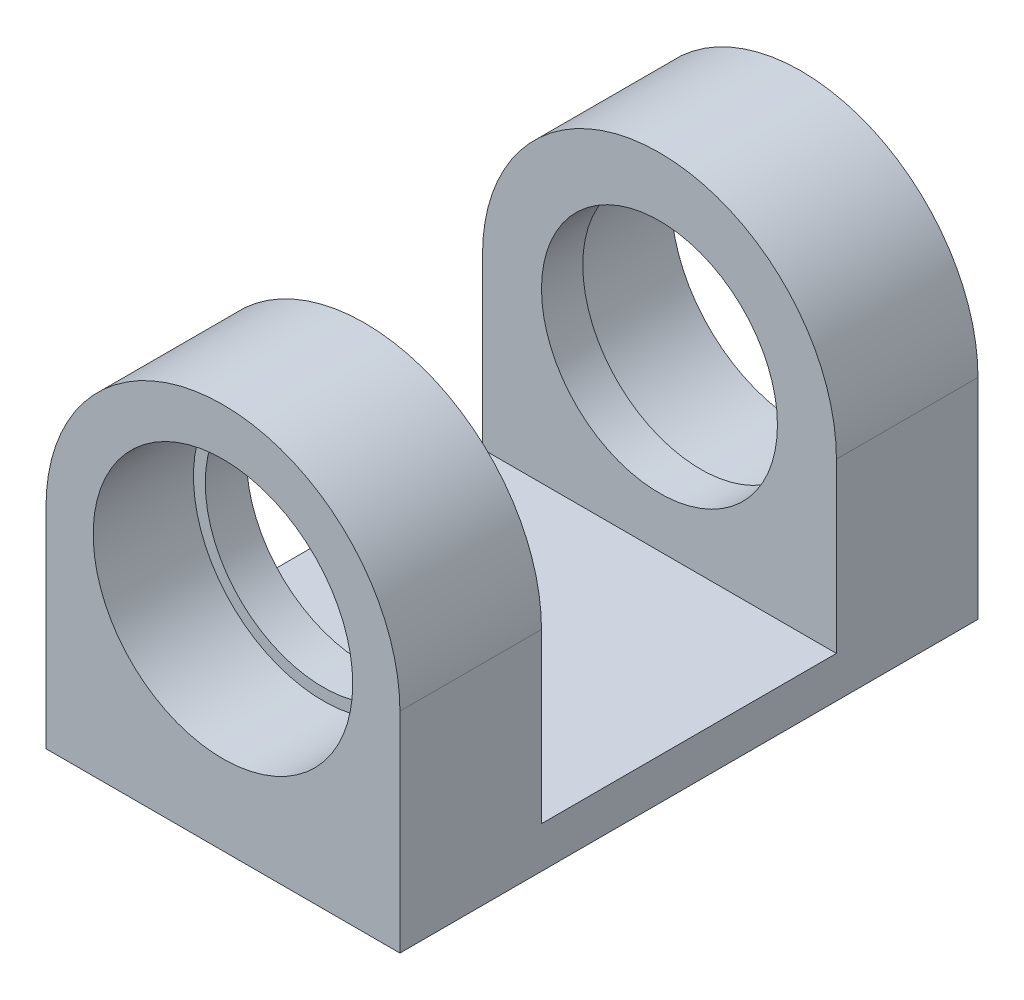
from build123d import *

# Parameters (mm, degrees)
SALIENTE_EXTRUIR1_DEPTH = 6
CROQUIS3_R              = 4
CORTAR_EXTRUIR1_DEPTH   = 47.013232879
CROQUIS4_R              = 11
CORTAR_EXTRUIR2_DEPTH   = 8.5
CROQUIS5_R              = 10
CORTAR_EXTRUIR3_DEPTH   = 8.5
CROQUIS6_W              = 30
CROQUIS6_H              = 3.5
SALIENTE_EXTRUIR2_DEPTH = 25


with BuildPart() as part:
    # Croquis2 → Saliente-Extruir1 (new, symmetric)
    with BuildSketch(Plane.XY):
        with BuildLine():
            Line((0, 0), (-30, 0))
            Line((-30, 0), (-30, 17.76))
            ThreePointArc((-30, 17.76), (-15, 32.76), (0, 17.76))
            Line((0, 17.76), (0, 0))
        make_face()
    saliente_extruir1 = extrude(amount=SALIENTE_EXTRUIR1_DEPTH, both=True)

    # Croquis3 → Cortar-Extruir1 (cut, through all)
    with BuildSketch(Plane.XY.offset(6)):
        with Locations((-15, 17.76)):
            Circle(CROQUIS3_R)
    extrude(amount=-CORTAR_EXTRUIR1_DEPTH, mode=Mode.SUBTRACT)

    # Croquis4 → Cortar-Extruir2 (cut)
    with BuildSketch(Plane.XY.offset(6)):
        with Locations((-15, 17.76)):
            Circle(CROQUIS4_R)
    cortar_extruir2 = extrude(amount=-CORTAR_EXTRUIR2_DEPTH, mode=Mode.SUBTRACT)

    # Croquis5 → Cortar-Extruir3 (cut)
    with BuildSketch(Plane.XY.offset(-2.5)):
        with Locations((-15, 17.76)):
            Circle(CROQUIS5_R)
    cortar_extruir3 = extrude(amount=-CORTAR_EXTRUIR3_DEPTH, mode=Mode.SUBTRACT)

    # Croquis6 → Saliente-Extruir2 (add)
    with BuildSketch(Plane(origin=(0, 0, -6), x_dir=(-1, 0, 0), z_dir=(0, 0, -1))):
        with Locations((15, 1.75)):
            Rectangle(CROQUIS6_W, CROQUIS6_H)
    extrude(amount=SALIENTE_EXTRUIR2_DEPTH)

    # Simetría1: Saliente-Extruir1, Cortar-Extruir2, Cortar-Extruir3 across plane
    add(saliente_extruir1.mirror(Plane(origin=(0, 0, -18.5), x_dir=(1, 0, 0), z_dir=(0, 0, -1))))
    add(cortar_extruir2.mirror(Plane(origin=(0, 0, -18.5), x_dir=(1, 0, 0), z_dir=(0, 0, -1))), mode=Mode.SUBTRACT)
    add(cortar_extruir3.mirror(Plane(origin=(0, 0, -18.5), x_dir=(1, 0, 0), z_dir=(0, 0, -1))), mode=Mode.SUBTRACT)


solid = part.part
